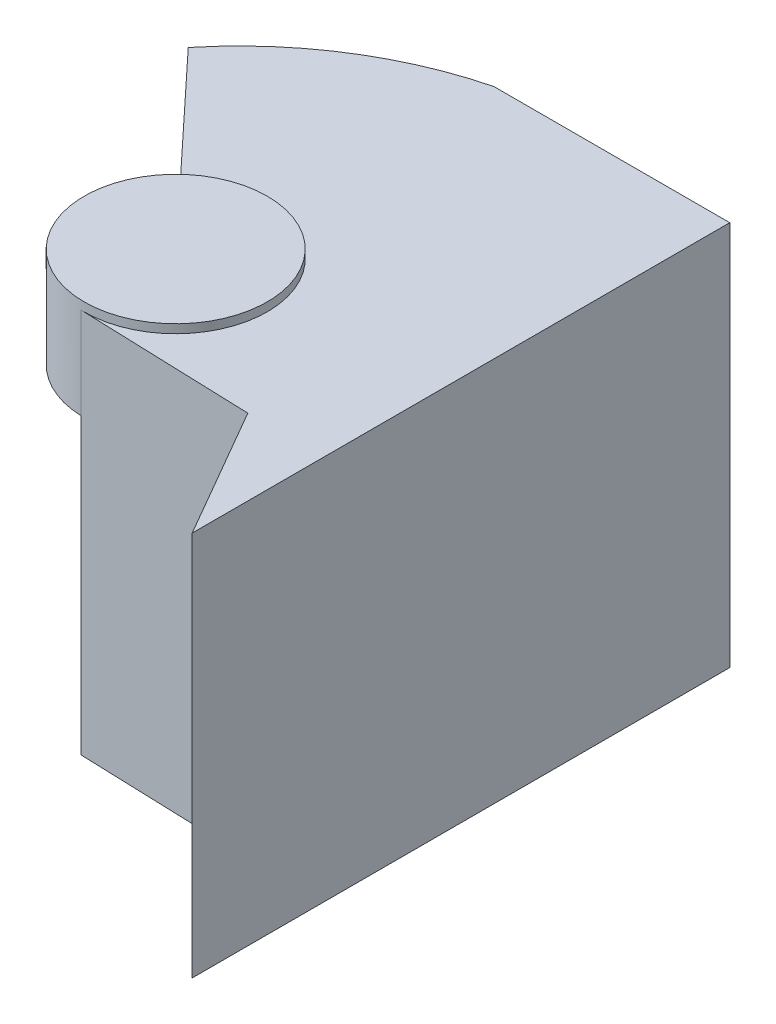
from build123d import *

# Parameters (mm, degrees)
BOSS_EXTRUDE1_DEPTH      = 223
BOSS_EXTRUDE2_DEPTH      = 5
BOSS_EXTRUDE2_DEPTH_BACK = 53
SKETCH3_R                = 53


with BuildPart() as part:
    # Sketch2 → Boss-Extrude1 (new body)
    with BuildSketch(Plane(origin=(0, 0, 0), x_dir=(1, 0, 0), z_dir=(0, 1, 0))):
        with BuildLine():
            Line((0, 0), (0, -311.121367585))
            Line((0, -311.121367585), (-44, -234.911132052))
            Line((-44, -234.911132052), (-143.9414944, -231.490942435))
            Line((-143.9414944, -231.490942435), (-142.128793904, -178.521950403))
            Line((-142.128793904, -178.521950403), (-244.505097616, -68.890328878))
            ThreePointArc((-244.505097616, -68.890328878), (-196.059281714, -25.695998193), (-136.456740169, 0))
            Line((-136.456740169, 0), (0, 0))
        make_face()
    extrude(amount=-BOSS_EXTRUDE1_DEPTH)

    # Sketch3 → Boss-Extrude2 (add, two sides: drawn at the far end of the back side and taken through both)
    with BuildSketch(Plane(origin=(0, 0, 0), x_dir=(1, 0, 0), z_dir=(0, 1, 0)).offset(-BOSS_EXTRUDE2_DEPTH_BACK)):
        with Locations(Location((-142.128793904, -178.521950403, 0), (0, 0, 270))):
            Circle(SKETCH3_R)
    extrude(amount=BOSS_EXTRUDE2_DEPTH + BOSS_EXTRUDE2_DEPTH_BACK)


solid = part.part
